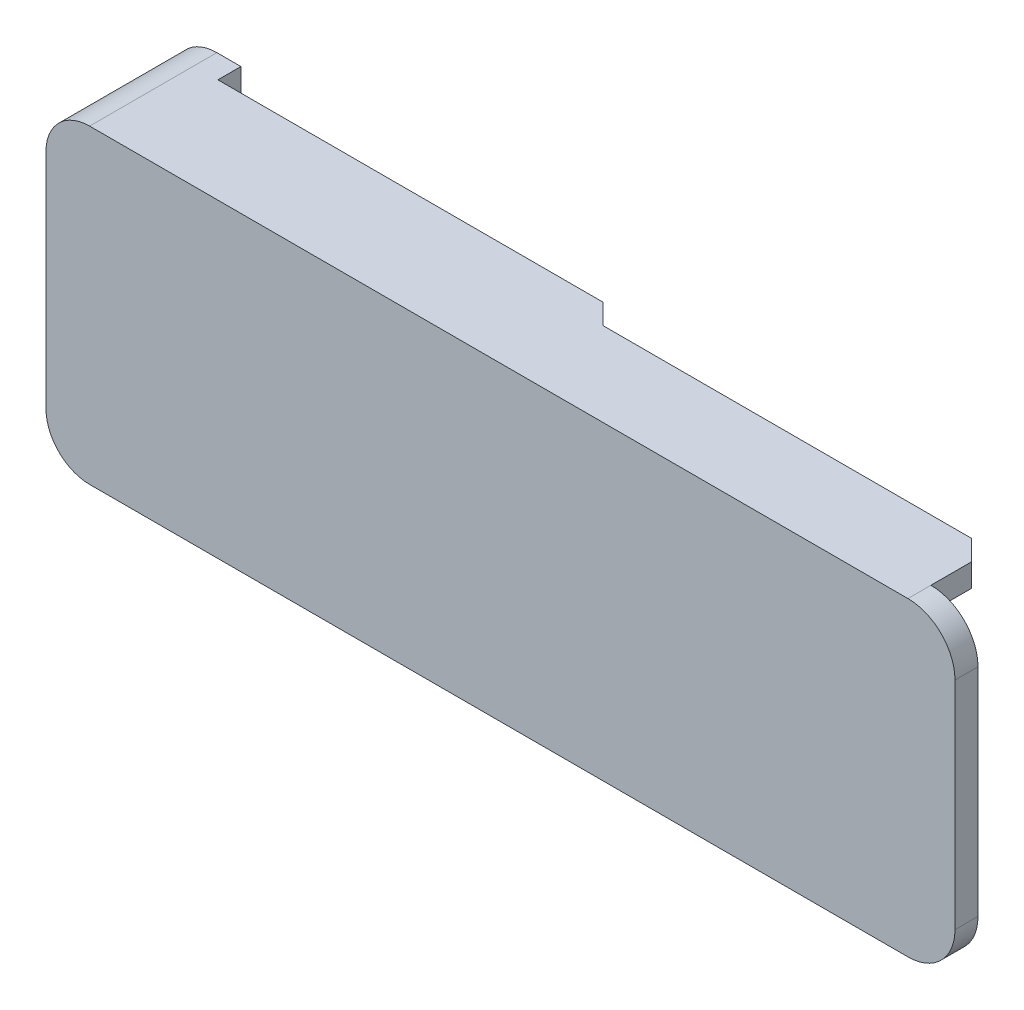
from build123d import *

# Parameters (mm, degrees)
BOSS_EXTRUDE1_DEPTH = 6
BOSS_EXTRUDE2_START = 1.7
BOSS_EXTRUDE2_DEPTH = 1.7
CUT_EXTRUDE3_DEPTH  = 29
BOSS_EXTRUDE5_DEPTH = 1.7
CUT_EXTRUDE4_DEPTH  = 85.274737764
SKETCH17_R          = 1.45
BOSS_EXTRUDE6_DEPTH = 2


with BuildPart() as part:
    # Sketch1 → Boss-Extrude1 (new body)
    with BuildSketch(Plane.XY):
        with BuildLine():
            Line((-65.499084074, 50.331718091), (-14.793168506, 50.331718091))
            Line((-14.793168506, 50.331718091), (-5.047168405, 50.331718091))
            ThreePointArc((-5.047168405, 50.331718091), (-2.58785102, 49.313035476), (-1.569168405, 46.853718091))
            Line((-1.569168405, 46.853718091), (-1.569168405, 43.965718386))
            Line((-1.569168405, 43.965718386), (-1.569168405, 33.805718061))
            Line((-1.569168405, 33.805718061), (-1.569168405, 30.881718108))
            ThreePointArc((-1.569168405, 30.881718108), (-2.58785102, 28.422400723), (-5.047168405, 27.403718108))
            Line((-5.047168405, 27.403718108), (-14.829168757, 27.403718108))
            Line((-14.829168757, 27.403718108), (-65.499083667, 27.403718108))
            ThreePointArc((-65.499083667, 27.403718108), (-67.778855129, 28.348030366), (-68.723167387, 30.627801828))
            Line((-68.723167387, 30.627801828), (-68.723167387, 47.107634778))
            ThreePointArc((-68.723167387, 47.107634778), (-67.778855248, 49.387405952), (-65.499084074, 50.331718091))
        make_face()
        with BuildLine():
            Line((-3.269168405, 43.965718386), (-3.269168405, 46.853718091))
            ThreePointArc((-3.269168405, 46.853718091), (-3.789932548, 48.110953948), (-5.047168405, 48.631718091))
            Line((-5.047168405, 48.631718091), (-14.793168506, 48.631718091))
            Line((-14.793168506, 48.631718091), (-65.499084074, 48.631718091))
            ThreePointArc((-65.499084074, 48.631718091), (-66.57677372, 48.185324424), (-67.023167387, 47.107634778))
            Line((-67.023167387, 47.107634778), (-67.023167387, 30.627801828))
            ThreePointArc((-67.023167387, 30.627801828), (-66.576773601, 29.550111894), (-65.499083667, 29.103718108))
            Line((-65.499083667, 29.103718108), (-14.829168757, 29.103718108))
            Line((-14.829168757, 29.103718108), (-5.047168405, 29.103718108))
            ThreePointArc((-5.047168405, 29.103718108), (-3.789932548, 29.624482251), (-3.269168405, 30.881718108))
            Line((-3.269168405, 30.881718108), (-3.269168405, 33.805718061))
            Line((-3.269168405, 33.805718061), (-3.269168405, 43.965718386))
        make_face(mode=Mode.SUBTRACT)
    extrude(amount=-BOSS_EXTRUDE1_DEPTH)

    # Sketch3 → Boss-Extrude2 (add)
    with BuildSketch(Plane.XY.offset(BOSS_EXTRUDE2_START)):
        with BuildLine():
            Line((-68.723167387, 47.107634778), (-68.723167387, 30.627801828))
            ThreePointArc((-68.723167387, 30.627801828), (-67.778855129, 28.348030366), (-65.499083667, 27.403718108))
            Line((-65.499083667, 27.403718108), (-5.047168405, 27.403718108))
            ThreePointArc((-5.047168405, 27.403718108), (-2.58785102, 28.422400723), (-1.569168405, 30.881718108))
            Line((-1.569168405, 30.881718108), (-1.569168405, 46.853718091))
            ThreePointArc((-1.569168405, 46.853718091), (-2.58785102, 49.313035476), (-5.047168405, 50.331718091))
            Line((-5.047168405, 50.331718091), (-65.499084074, 50.331718091))
            ThreePointArc((-65.499084074, 50.331718091), (-67.778855248, 49.387405952), (-68.723167387, 47.107634778))
        make_face()
    extrude(amount=-BOSS_EXTRUDE2_DEPTH)

    # Sketch11 → Cut-Extrude3 (cut)
    with BuildSketch(Plane(origin=(0, 50.331718091, 0), x_dir=(1, 0, 0), z_dir=(0, 1, 0))):
        Polygon((-35.27312624, 6), (-33.77312624, 4.5), (-6.547168405, 4.5), (-5.047168405, 3), (-5.047168405, 0), (-1.569168405, 0), (-1.569168405, 6), align=None)
    extrude(amount=-CUT_EXTRUDE3_DEPTH, mode=Mode.SUBTRACT)

    # Sketch13 → Revolve3 (revolve)
    with BuildSketch(Plane(origin=(0, 0, -2.25), x_dir=(-1, 0, 0), z_dir=(0, 0, -1))):
        with BuildLine():
            Line((8.547168405, 29.103718108), (8.547168405, 30.103718108))
            ThreePointArc((8.547168405, 30.103718108), (9.254275186, 29.810824889), (9.547168405, 29.103718108))
            Line((9.547168405, 29.103718108), (8.547168405, 29.103718108))
        make_face()
    revolve3 = revolve(axis=Axis((-8.547168405, 29.103718108, -2.25), (0, 1, 0)))

    # Mirror3: Revolve3 across plane
    add(revolve3.mirror(Plane(origin=(0, 38.867718099, 0), x_dir=(0, 0, 1), z_dir=(0, -1, 0))))

    # Sketch14 → Boss-Extrude5 (add)
    with BuildSketch(Plane(origin=(0, 0, -6), x_dir=(-1, 0, 0), z_dir=(0, 0, -1))):
        with BuildLine():
            Line((63.723167387, 27.403718108), (63.723167387, 50.331718091))
            Line((63.723167387, 50.331718091), (65.499084074, 50.331718091))
            ThreePointArc((65.499084074, 50.331718091), (67.778855248, 49.387405952), (68.723167387, 47.107634778))
            Line((68.723167387, 47.107634778), (68.723167387, 30.627801828))
            ThreePointArc((68.723167387, 30.627801828), (67.778855129, 28.348030366), (65.499083667, 27.403718108))
            Line((65.499083667, 27.403718108), (63.723167387, 27.403718108))
        make_face()
    extrude(amount=BOSS_EXTRUDE5_DEPTH)

    # Sketch15 → Cut-Extrude4 (cut, through all)
    with BuildSketch(Plane.ZY.offset(68.723167387)):
        with BuildLine():
            ThreePointArc((-2.341753072, 42.182977625), (-3.416753072, 41.107977625), (-2.341753072, 40.032977625))
            Line((-2.341753072, 40.032977625), (-2.341753072, 42.182977625))
        make_face()
        with BuildLine():
            Line((-2.341753072, 42.182977625), (-2.341753072, 40.032977625))
            ThreePointArc((-2.341753072, 40.032977625), (-1.581613282, 40.347837835), (-1.266753072, 41.107977625))
            ThreePointArc((-1.266753072, 41.107977625), (-1.581613282, 41.868117415), (-2.341753072, 42.182977625))
        make_face()
        with BuildLine():
            ThreePointArc((-2.341753072, 37.718380266), (-3.416753072, 36.643380266), (-2.341753072, 35.568380266))
            Line((-2.341753072, 35.568380266), (-2.341753072, 37.718380266))
        make_face()
        with BuildLine():
            Line((-2.341753072, 37.718380266), (-2.341753072, 35.568380266))
            ThreePointArc((-2.341753072, 35.568380266), (-1.581613282, 35.883240476), (-1.266753072, 36.643380266))
            ThreePointArc((-1.266753072, 36.643380266), (-1.581613282, 37.403520056), (-2.341753072, 37.718380266))
        make_face()
    extrude(amount=-CUT_EXTRUDE4_DEPTH, mode=Mode.SUBTRACT)

    # Sketch17 → Boss-Extrude6 (add)
    with BuildSketch(Plane(origin=(0, 0, 0), x_dir=(-1, 0, 0), z_dir=(0, 0, -1))):
        with Locations(Location((14.904168421, 32.641718081, 0), (0, 0, 180))):
            Circle(SKETCH17_R)
        with Locations(Location((60.982168421, 45.218718081, 0), (0, 0, 180))):
            Circle(SKETCH17_R)
    extrude(amount=BOSS_EXTRUDE6_DEPTH)


solid = part.part
